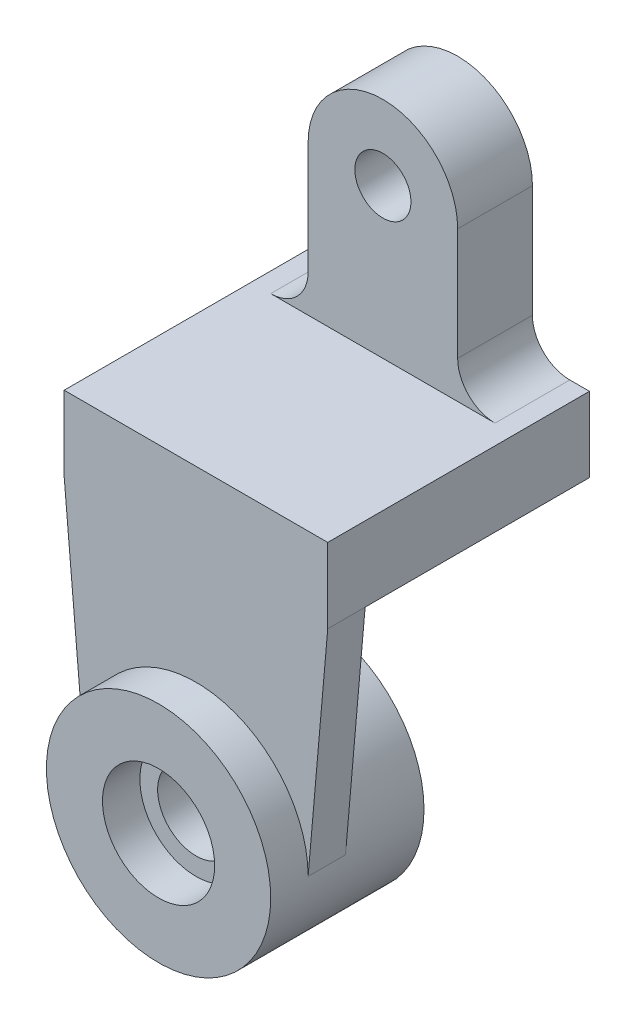
from build123d import *

# Parameters (mm, degrees)
SKETCH1_R           = 762
SKETCH1_R_2         = 381
BOSS_EXTRUDE1_DEPTH = 533.4
BOSS_EXTRUDE3_START = 254
BOSS_EXTRUDE3_DEPTH = 254
SKETCH6_R           = 260.35
CUT_EXTRUDE1_DEPTH  = 254
BOSS_EXTRUDE4_START = 254
SKETCH7_R           = 762
SKETCH7_R_2         = 381
BOSS_EXTRUDE4_DEPTH = 254
SKETCH8_W           = 1790.7
SKETCH8_H           = 508
BOSS_EXTRUDE5_DEPTH = 1524
BOSS_EXTRUDE6_DEPTH = 508
SKETCH10_R          = 190.5
CUT_EXTRUDE2_DEPTH  = 508


with BuildPart() as part:
    # Sketch1 → Boss-Extrude1 (new body)
    with BuildSketch(Plane.XY):
        Circle(SKETCH1_R)
        Circle(SKETCH1_R_2, mode=Mode.SUBTRACT)
    extrude(amount=-BOSS_EXTRUDE1_DEPTH)

    # Sketch3 → Boss-Extrude3 (add)
    with BuildSketch(Plane.XY.offset(BOSS_EXTRUDE3_START)):
        with BuildLine():
            Line((-895.35, 2032), (-895.35, 1524))
            Line((-895.35, 1524), (-762, 0))
            ThreePointArc((-762, 0), (0, -762), (762, 0))
            Line((762, 0), (895.35, 1524))
            Line((895.35, 1524), (895.35, 2032))
            Line((895.35, 2032), (-895.35, 2032))
        make_face()
    extrude(amount=-BOSS_EXTRUDE3_DEPTH)

    # Sketch6 → Cut-Extrude1 (cut)
    with BuildSketch(Plane.XY.offset(254)):
        Circle(SKETCH6_R)
    extrude(amount=-CUT_EXTRUDE1_DEPTH, mode=Mode.SUBTRACT)

    # Sketch7 → Boss-Extrude4 (add)
    with BuildSketch(Plane.XY.offset(254).offset(BOSS_EXTRUDE4_START)):
        Circle(SKETCH7_R)
        Circle(SKETCH7_R_2, mode=Mode.SUBTRACT)
    extrude(amount=-BOSS_EXTRUDE4_DEPTH)

    # Sketch8 → Boss-Extrude5 (add)
    with BuildSketch(Plane(origin=(0, 0, 0), x_dir=(-1, 0, 0), z_dir=(0, 0, -1))):
        with Locations((0, 1778)):
            Rectangle(SKETCH8_W, SKETCH8_H)
    extrude(amount=BOSS_EXTRUDE5_DEPTH)

    # Sketch9 → Boss-Extrude6 (add)
    with BuildSketch(Plane(origin=(0, 0, -1524), x_dir=(-1, 0, 0), z_dir=(0, 0, -1))):
        with BuildLine():
            Line((-508, 3048), (-508, 2286))
            ThreePointArc((-508, 2286), (-582.394877579, 2106.394877579), (-762, 2032))
            Line((-762, 2032), (-895.35, 2032))
            Line((-895.35, 2032), (-895.35, 1524))
            Line((-895.35, 1524), (895.35, 1524))
            Line((895.35, 1524), (895.35, 2032))
            Line((895.35, 2032), (762, 2032))
            ThreePointArc((762, 2032), (582.394877579, 2106.394877579), (508, 2286))
            Line((508, 2286), (508, 3048))
            ThreePointArc((508, 3048), (0, 3556), (-508, 3048))
        make_face()
    extrude(amount=-BOSS_EXTRUDE6_DEPTH)

    # Sketch10 → Cut-Extrude2 (cut)
    with BuildSketch(Plane(origin=(0, 0, -1524), x_dir=(-1, 0, 0), z_dir=(0, 0, -1))):
        with Locations((0, 3048)):
            Circle(SKETCH10_R)
    extrude(amount=-CUT_EXTRUDE2_DEPTH, mode=Mode.SUBTRACT)


solid = part.part
